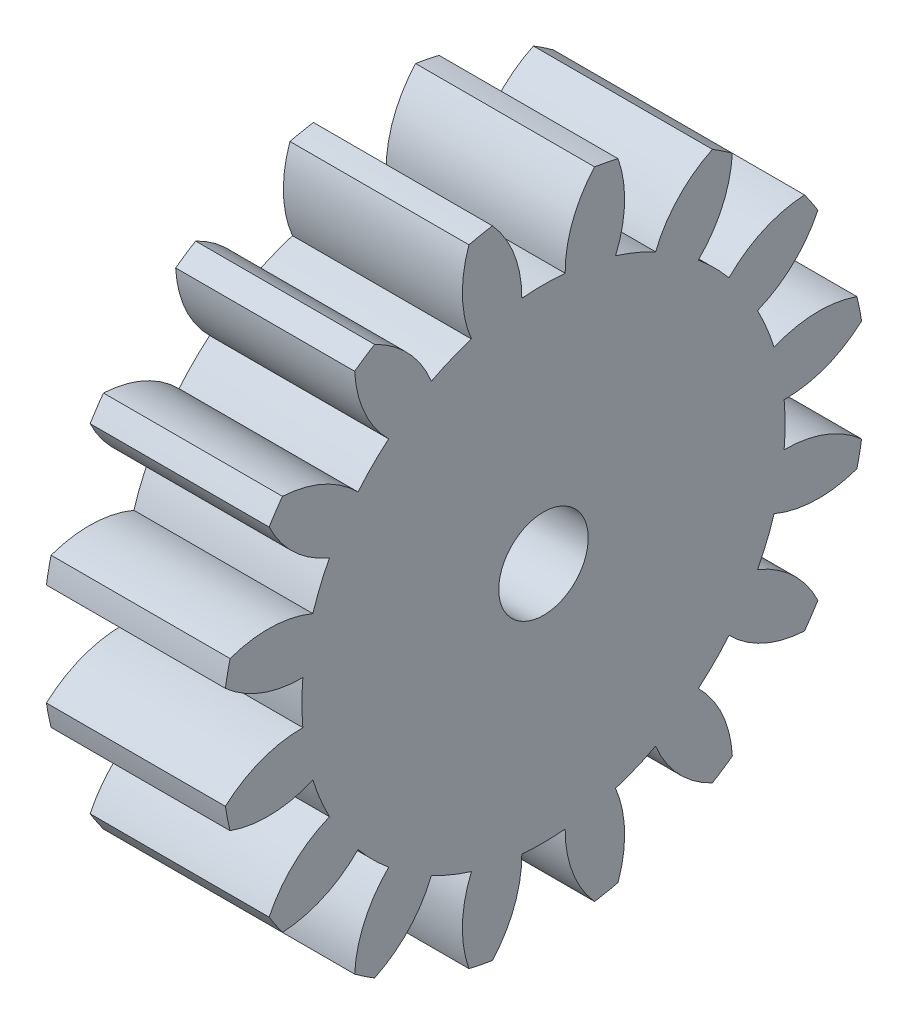
from build123d import *

# Parameters (mm, degrees)
BASPROSKE_W     = 10
BASPROSKE_H     = 18
TOOTHCUT_DEPTH  = 28.349588662
TEETHCUTS_COUNT = 16
TEETHCUTS_ANGLE = 337.5
BORSKE_R        = 2.5
BORE_DEPTH      = 50.0000508


with BuildPart() as part:
    # BasProSke → Base-Revolve (revolve)
    with BuildSketch(Plane(origin=(0, 0, 0), x_dir=(1, 0, 0), z_dir=(0, 1, 0)), mode=Mode.PRIVATE) as base_revolve_sk:
        with Locations((5, 9)):
            Rectangle(BASPROSKE_W, BASPROSKE_H)
    revolve(base_revolve_sk.sketch.rotate(Axis((-10, 0, 0), (1, 0, 0)), 180), axis=Axis((-10, 0, 0), (1, 0, 0)))

    # TooCutSke → ToothCut (cut, through all)
    with BuildSketch(Plane(origin=(0, 0, 0), x_dir=(0, 0, -1), z_dir=(1, 0, 0))):
        with BuildLine():
            ThreePointArc((1.210794474, 13.444589162), (0, 13.499), (-1.210794474, 13.444589162))
            ThreePointArc((-1.210794474, 13.444589162), (-1.632237109, 15.776340848), (-2.873179402, 17.794939879))
            ThreePointArc((-2.873179402, 17.794939879), (0, 18.0254), (2.873179402, 17.794939879))
            ThreePointArc((2.873179402, 17.794939879), (1.632237109, 15.776340848), (1.210794474, 13.444589162))
        make_face()
    toothcut = extrude(amount=TOOTHCUT_DEPTH, mode=Mode.SUBTRACT)

    # TeethCuts: ToothCut ×16 about axis
    teethcuts_axis = Axis((-10, 0, 0), (1, 0, 0))
    for i in range(1, TEETHCUTS_COUNT):
        add(toothcut.rotate(teethcuts_axis, i * TEETHCUTS_ANGLE / (TEETHCUTS_COUNT - 1)), mode=Mode.SUBTRACT)

    # BorSke → Bore (cut, symmetric)
    with BuildSketch(Plane(origin=(0, 0, 0), x_dir=(0, 0, -1), z_dir=(1, 0, 0))):
        with Locations(Location((0, 0, 0), (0, 0, 180))):
            Circle(BORSKE_R)
    extrude(amount=BORE_DEPTH, both=True, mode=Mode.SUBTRACT)


solid = part.part
